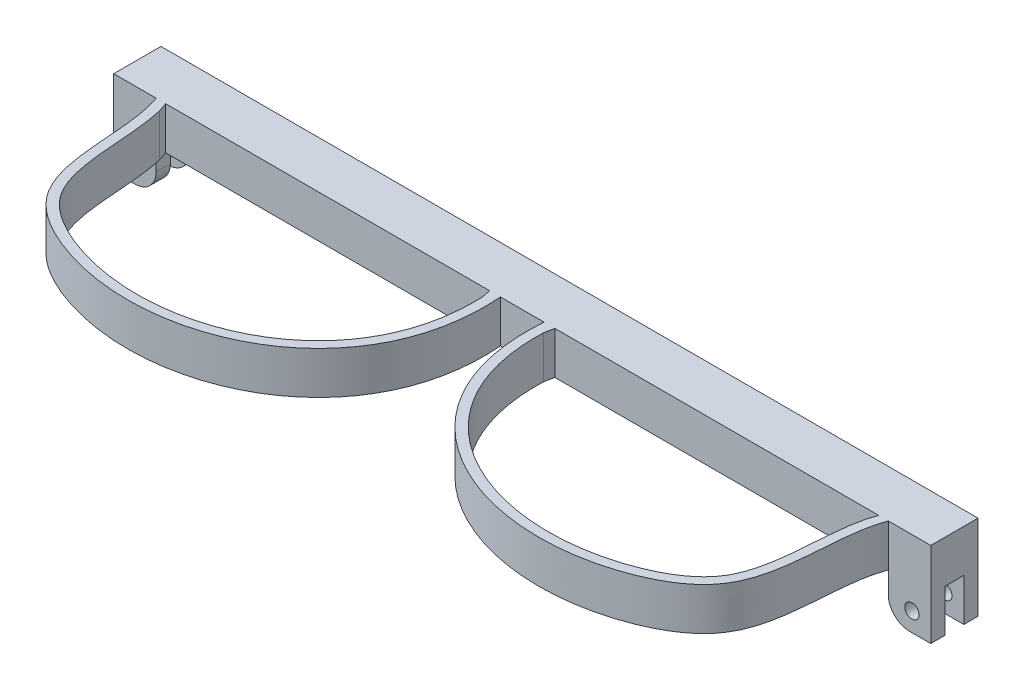
from build123d import *

# Parameters (mm, degrees)
FRAME_DEPTH             = 9
SKETCH_5_W              = 10
SKETCH_5_H              = 9
CONNECTION_DEPTH        = 9
CONNECTION_2_DEPTH      = 5
CONNECTION_START        = -5
CONNECTION_3_DEPTH      = 5
CONNECTION_START_2      = -2
CONNECTION_4_DEPTH      = 2
CONNECTION_5_DEPTH      = 2
SKETCH_1966_W           = 6
SKETCH_1966_H           = 7.2
CUT_EXTRUDE_2047_DEPTH  = 155
SKETCH_12_W             = 10
SKETCH_12_H             = 9
CONNECTION_6_DEPTH      = 9
CONNECTION_7_DEPTH      = 5
CONNECTION_8_DEPTH      = 5
CONNECTION_9_DEPTH      = 2
CONNECTION_10_DEPTH     = 2
SKETCH_2692_OUTSIDE_W   = 211.196
SKETCH_2692_OUTSIDE_H   = 56.196
SKETCH_2692_OUTSIDE_R   = 1.5
SKETCH_2692_OUTSIDE_R_2 = 1.935432659
CUT_EXTRUDE_3247_DEPTH  = 101.317909756


with BuildPart() as part:
    # 草图1 → frame (new body)
    with BuildSketch(Plane(origin=(0, 0, 0), x_dir=(1, 0, 0), z_dir=(0, 1, 0))):
        with BuildLine():
            Line((77.5, 21.66163142), (-77.5, 21.66163142))
            Line((-77.5, 21.66163142), (-77.5, 11.66163142))
            add(Edge.make_bspline(
                [(-77.5, 11.66163142), (-74.407700798, 3.186863233), (-78.13080327, -15.927288699), (-40.25886312, -37.426028597), (-2.116282918, -20.689046368), (-4.622356495, 11.66163142)],
                knots=[0, 0, 0, 0, 0.2461215, 0.369792099, 1, 1, 1, 1], degree=3))
            Line((-4.622356495, 11.66163142), (4.622356495, 11.66163142))
            add(Edge.make_bspline(
                [(77.5, 11.66163142), (74.407700798, 3.186863233), (78.13080327, -15.927288699), (40.25886312, -37.426028597), (2.116282918, -20.689046368), (4.622356495, 11.66163142)],
                knots=[0, 0, 0, 0, 0.2461215, 0.369792099, 1, 1, 1, 1], degree=3))
            Line((77.5, 11.66163142), (77.5, 21.66163142))
        make_face()
        with BuildLine():
            Line((6.907388487, 11.66163142), (75.498489426, 11.66163142))
            Line((75.498489426, 11.66163142), (74.826320569, 9.66163142))
            add(Edge.make_bspline(
                [(74.826320569, 9.66163142), (74.537129512, 8.440205397), (74.118616889, 5.97852646), (73.621822389, 0.86906895), (73.254603503, -5.556962308), (72.241025744, -11.370637322), (70.601393479, -15.207799235), (68.270143007, -18.43048657), (63.731478169, -21.762919869), (56.85425746, -24.533410045), (49.722568077, -26.119696622), (40.058249914, -26.656581209), (30.63607695, -24.877975202), (22.314225365, -20.908251341), (16.828859323, -16.874650673), (12.291217041, -11.816635216), (9.449850549, -6.759991518), (7.834253455, -2.202532167), (6.977086921, 1.473147324), (6.581231794, 4.759863142), (6.469661343, 7.510165764), (6.485645336, 8.950311376), (6.511310136, 9.66163142)],
                knots=[0.022831488, 0.022831488, 0.022831488, 0.022831488, 0.052972273, 0.083113058, 0.143394628, 0.203676198, 0.233816983, 0.263957769, 0.324239339, 0.384520909, 0.444802479, 0.505084049, 0.625647189, 0.685928759, 0.746210329, 0.806491899, 0.866773469, 0.896914254, 0.92705504, 0.957195825, 0.972266217, 0.98733661, 0.98733661, 0.98733661, 0.98733661], degree=3))
            Line((6.511310136, 9.66163142), (6.907388487, 11.66163142))
        make_face(mode=Mode.SUBTRACT)
        with BuildLine():
            Line((-75.498489426, 11.66163142), (-6.907388487, 11.66163142))
            Line((-6.907388487, 11.66163142), (-6.511310136, 9.66163142))
            add(Edge.make_bspline(
                [(-74.826320569, 9.66163142), (-74.537129512, 8.440205397), (-74.118616889, 5.97852646), (-73.621822389, 0.86906895), (-73.254603503, -5.556962308), (-72.241025744, -11.370637322), (-70.601393479, -15.207799235), (-68.270143007, -18.43048657), (-63.731478169, -21.762919869), (-56.85425746, -24.533410045), (-49.722568077, -26.119696622), (-40.058249914, -26.656581209), (-30.63607695, -24.877975202), (-22.314225365, -20.908251341), (-16.828859323, -16.874650673), (-12.291217041, -11.816635216), (-9.449850549, -6.759991518), (-7.834253455, -2.202532167), (-6.977086921, 1.473147324), (-6.581231794, 4.759863142), (-6.469661343, 7.510165764), (-6.485645336, 8.950311376), (-6.511310136, 9.66163142)],
                knots=[0.022831488, 0.022831488, 0.022831488, 0.022831488, 0.052972273, 0.083113058, 0.143394628, 0.203676198, 0.233816983, 0.263957769, 0.324239339, 0.384520909, 0.444802479, 0.505084049, 0.625647189, 0.685928759, 0.746210329, 0.806491899, 0.866773469, 0.896914254, 0.92705504, 0.957195825, 0.972266217, 0.98733661, 0.98733661, 0.98733661, 0.98733661], degree=3))
            Line((-74.826320569, 9.66163142), (-75.498489426, 11.66163142))
        make_face(mode=Mode.SUBTRACT)
    extrude(amount=FRAME_DEPTH)

    # 草图5 → connection (add)
    with BuildSketch(Plane(origin=(86.5, 0, 0), x_dir=(0, 0, -1), z_dir=(1, 0, 0))):
        with Locations((16.66163142, 4.5)):
            Rectangle(SKETCH_5_W, SKETCH_5_H)
    extrude(amount=-CONNECTION_DEPTH)

    # 草图9 → connection 2 (add)
    with BuildSketch(Plane(origin=(0, 0, -16.66163142), x_dir=(-1, 0, 0), z_dir=(0, 0, -1))):
        with BuildLine():
            Line((-86.5, 0), (-86.5, -9))
            Line((-86.5, -9), (-82, -9))
            ThreePointArc((-82, -9), (-78.818019485, -7.681980515), (-77.5, -4.5))
            Line((-77.5, -4.5), (-77.5, 0))
            Line((-77.5, 0), (-86.5, 0))
        make_face()
    extrude(amount=CONNECTION_2_DEPTH)

    # 草图9<3> → connection 3 (add)
    with BuildSketch(Plane(origin=(0, 0, -16.66163142), x_dir=(-1, 0, 0), z_dir=(0, 0, -1)).offset(CONNECTION_START)):
        with BuildLine():
            Line((-86.5, 0), (-86.5, -9))
            Line((-86.5, -9), (-82, -9))
            ThreePointArc((-82, -9), (-78.818019485, -7.681980515), (-77.5, -4.5))
            Line((-77.5, -4.5), (-77.5, 0))
            Line((-77.5, 0), (-86.5, 0))
        make_face()
    extrude(amount=CONNECTION_3_DEPTH)

    # 草图9<4> → connection 4 (cut)
    with BuildSketch(Plane(origin=(0, 0, -16.66163142), x_dir=(-1, 0, 0), z_dir=(0, 0, -1)).offset(CONNECTION_START_2)):
        with BuildLine():
            Line((-86.5, 0), (-86.5, -9))
            Line((-86.5, -9), (-82, -9))
            ThreePointArc((-82, -9), (-78.818019485, -7.681980515), (-77.5, -4.5))
            Line((-77.5, -4.5), (-77.5, 0))
            Line((-77.5, 0), (-86.5, 0))
        make_face()
    extrude(amount=CONNECTION_4_DEPTH, mode=Mode.SUBTRACT)

    # 草图9<6> → connection 5 (cut)
    with BuildSketch(Plane(origin=(0, 0, -16.66163142), x_dir=(-1, 0, 0), z_dir=(0, 0, -1))):
        with BuildLine():
            Line((-86.5, 0), (-86.5, -9))
            Line((-86.5, -9), (-82, -9))
            ThreePointArc((-82, -9), (-78.818019485, -7.681980515), (-77.5, -4.5))
            Line((-77.5, -4.5), (-77.5, 0))
            Line((-77.5, 0), (-86.5, 0))
        make_face()
    extrude(amount=CONNECTION_5_DEPTH, mode=Mode.SUBTRACT)

    # Sketch 1966 → Cut-Extrude 2047 (cut)
    with BuildSketch(Plane(origin=(77.5, 0, 0), x_dir=(0, 0, -1), z_dir=(1, 0, 0))):
        with Locations((16.66163142, 3.6)):
            Rectangle(SKETCH_1966_W, SKETCH_1966_H)
    extrude(amount=-CUT_EXTRUDE_2047_DEPTH, mode=Mode.SUBTRACT)

    # 草图12 → connection 6 (add)
    with BuildSketch(Plane.ZY.offset(86.5)):
        with Locations((-16.66163142, 4.5)):
            Rectangle(SKETCH_12_W, SKETCH_12_H)
    extrude(amount=-CONNECTION_6_DEPTH)

    # 草图13 → connection 7 (add)
    with BuildSketch(Plane(origin=(0, 0, -16.66163142), x_dir=(-1, 0, 0), z_dir=(0, 0, -1))):
        with BuildLine():
            Line((86.5, 0), (77.5, 0))
            Line((77.5, 0), (77.5, -4.5))
            ThreePointArc((77.5, -4.5), (78.818019485, -7.681980515), (82, -9))
            Line((82, -9), (86.5, -9))
            Line((86.5, -9), (86.5, 0))
        make_face()
    extrude(amount=CONNECTION_7_DEPTH)

    # 草图13<2> → connection 8 (add)
    with BuildSketch(Plane(origin=(0, 0, -16.66163142), x_dir=(-1, 0, 0), z_dir=(0, 0, -1)).offset(CONNECTION_START)):
        with BuildLine():
            Line((86.5, 0), (77.5, 0))
            Line((77.5, 0), (77.5, -4.5))
            ThreePointArc((77.5, -4.5), (78.818019485, -7.681980515), (82, -9))
            Line((82, -9), (86.5, -9))
            Line((86.5, -9), (86.5, 0))
        make_face()
    extrude(amount=CONNECTION_8_DEPTH)

    # 草图13<3> → connection 9 (cut)
    with BuildSketch(Plane(origin=(0, 0, -16.66163142), x_dir=(-1, 0, 0), z_dir=(0, 0, -1)).offset(CONNECTION_START_2)):
        with BuildLine():
            Line((86.5, 0), (77.5, 0))
            Line((77.5, 0), (77.5, -4.5))
            ThreePointArc((77.5, -4.5), (78.818019485, -7.681980515), (82, -9))
            Line((82, -9), (86.5, -9))
            Line((86.5, -9), (86.5, 0))
        make_face()
    extrude(amount=CONNECTION_9_DEPTH, mode=Mode.SUBTRACT)

    # 草图13<4> → connection 10 (cut)
    with BuildSketch(Plane(origin=(0, 0, -16.66163142), x_dir=(-1, 0, 0), z_dir=(0, 0, -1))):
        with BuildLine():
            Line((86.5, 0), (77.5, 0))
            Line((77.5, 0), (77.5, -4.5))
            ThreePointArc((77.5, -4.5), (78.818019485, -7.681980515), (82, -9))
            Line((82, -9), (86.5, -9))
            Line((86.5, -9), (86.5, 0))
        make_face()
    extrude(amount=CONNECTION_10_DEPTH, mode=Mode.SUBTRACT)

    # Sketch 2692 outside → Cut-Extrude 3247 (cut, through all)
    # profile 1 of 3: a face of its own
    with BuildSketch(Plane(origin=(0, 0, -21.66163142), x_dir=(-1, 0, 0), z_dir=(0, 0, -1))):
        Rectangle(SKETCH_2692_OUTSIDE_W, SKETCH_2692_OUTSIDE_H)
        with BuildLine():
            Line((-86.5, 9), (-86.5, -9))
            Line((-86.5, -9), (-82, -9))
            ThreePointArc((-82, -9), (-78.818019485, -7.681980515), (-77.5, -4.5))
            Line((-77.5, -4.5), (-77.5, 0))
            Line((-77.5, 0), (77.5, 0))
            Line((77.5, 0), (77.5, -4.5))
            ThreePointArc((77.5, -4.5), (78.818019485, -7.681980515), (82, -9))
            Line((82, -9), (86.5, -9))
            Line((86.5, -9), (86.5, 9))
            Line((86.5, 9), (-86.5, 9))
        make_face(mode=Mode.SUBTRACT)
    # profile 2 of 3: a face of its own
    with BuildSketch(Plane(origin=(0, 0, -21.66163142), x_dir=(-1, 0, 0), z_dir=(0, 0, -1))):
        with Locations((-82.5, -5)):
            Circle(SKETCH_2692_OUTSIDE_R)
    # profile 3 of 3: a face of its own
    with BuildSketch(Plane(origin=(0, 0, -21.66163142), x_dir=(-1, 0, 0), z_dir=(0, 0, -1))):
        with Locations((82, -4.5)):
            Circle(SKETCH_2692_OUTSIDE_R_2)
    extrude(amount=-CUT_EXTRUDE_3247_DEPTH, mode=Mode.SUBTRACT)


solid = part.part
